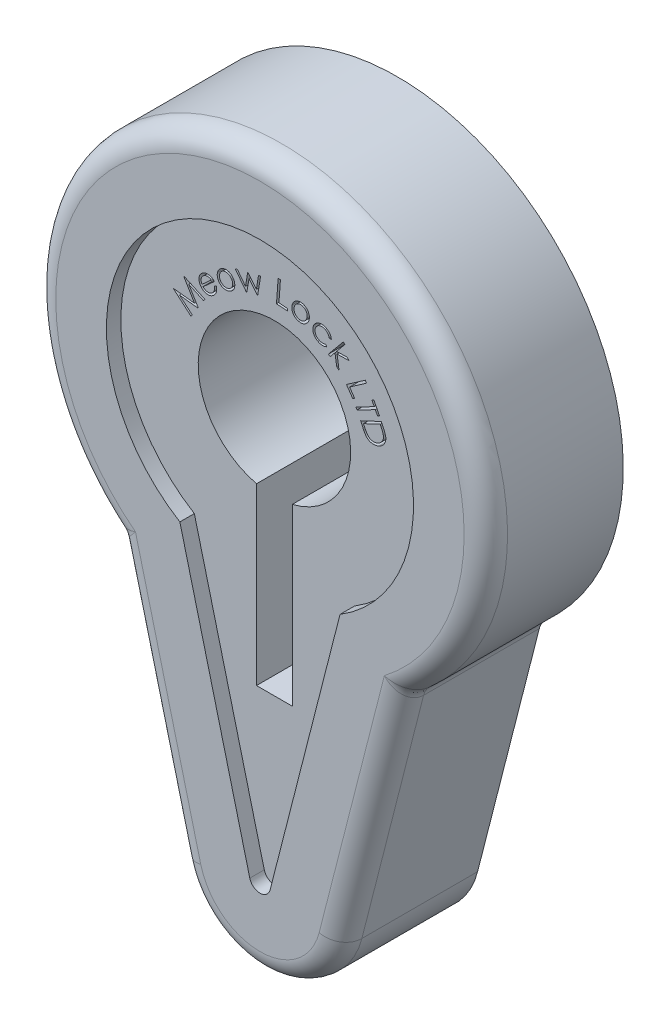
from build123d import *

# Parameters (mm, degrees)
BOSS_EXTRUDE1_DEPTH = 19.000000000000004
FILLET1_R           = 3
FILLET2_R           = 3
FILLET3_R           = 3
CUT_EXTRUDE1_DEPTH  = 1.9999999999999931
CUT_EXTRUDE2_DEPTH  = 79.2107454216423
CUT_EXTRUDE3_DEPTH  = 1.9999999999999931


with BuildPart() as part:
    # Sketch1 → Boss-Extrude1 (new body)
    with BuildSketch(Plane.XY):
        with BuildLine():
            Line((-19.865409477862748, 14.323703405468555), (-11.092882201578892, -19.992359175288826))
            ThreePointArc((-11.092882201578892, -19.992359175288826), (7e-16, -28.606198394562625), (11.092882201578892, -19.992359175288826))
            Line((11.092882201578892, -19.992359175288826), (19.865409477862748, 14.323703405468555))
            ThreePointArc((19.865409477862748, 14.323703405468555), (-5.74e-15, 69.65907877665661), (-19.865409477862748, 14.323703405468555))
        make_face()
    extrude(amount=BOSS_EXTRUDE1_DEPTH)

    # Fillet1
    fillet1_edges = [part.edges().sort_by_distance(p)[0] for p in [
        (15.47914583972082, -2.8343278849101345, 19.000000000000004),
        (-15.47914583972082, -2.8343278849101363, 19.000000000000004),
        (0, -28.606198394562625, 19.000000000000004),
    ]]
    fillet(fillet1_edges, radius=FILLET1_R)

    # Fillet2
    fillet2_edges = [part.edges().sort_by_distance(p)[0] for p in [
        (0, 69.6590787766566, 18.99999999999999),
    ]]
    fillet(fillet2_edges, radius=FILLET2_R)

    # Fillet3
    fillet3_edges = [part.edges().sort_by_distance(p)[0] for p in [
        (-19.86540947786275, 14.323703405468557, 8.000000000000004),
        (19.865409477862748, 14.323703405468557, 8.000000000000004),
        (19.05961196118904, 14.838238555596135, 18.150366096906286),
        (-19.05961189146557, 14.838238600458348, 18.150366161518555),
    ]]
    fillet(fillet3_edges, radius=FILLET3_R)

    # Sketch2 → Cut-Extrude1 (cut)
    with BuildSketch(Plane.XY.offset(19.000000000000004)):
        with BuildLine():
            Line((1.4044485365088668, -17.51561673459423), (11.073713446213294, 20.308272471014167))
            ThreePointArc((11.073713446213294, 20.308272471014167), (-3.41e-15, 59.659078776656614), (-11.07371344621329, 20.30827247101416))
            Line((-11.07371344621329, 20.30827247101416), (-1.404448536508866, -17.51561673459423))
            ThreePointArc((-1.404448536508866, -17.51561673459423), (9e-17, -18.60619839456262), (1.4044485365088668, -17.51561673459423))
        make_face()
    extrude(amount=-CUT_EXTRUDE1_DEPTH, mode=Mode.SUBTRACT)

    # Sketch3 → Cut-Extrude2 (cut, through all)
    with BuildSketch(Plane.XY.offset(17.000000000000007)):
        with BuildLine():
            Line((-2.4743668014019495, 28.18068150354432), (-2.4743668014019504, 4.013199385111004))
            Line((-2.4743668014019504, 4.013199385111004), (2.4743668014019504, 4.013199385111004))
            Line((2.4743668014019504, 4.013199385111004), (2.4743668014019495, 28.18068150354432))
            ThreePointArc((2.4743668014019495, 28.18068150354432), (2.99e-15, 48.96498797298128), (-2.4743668014019495, 28.18068150354432))
        make_face()
    extrude(amount=-CUT_EXTRUDE2_DEPTH, mode=Mode.SUBTRACT)

    # Sketch4 → Cut-Extrude3 (cut)
    # profile 1 of 11: a face of its own
    with BuildSketch(Plane.XY.offset(17.000000000000007)):
        Polygon((-11.528220411843778, 43.698989552974446), (-13.946995451907881, 45.777495161948806), (-13.91964669389506, 45.82074436066675), (-11.044847014407882, 45.507187669961624), (-12.543304546459163, 47.973028014512906), (-12.515955788446341, 48.01627721323085), (-9.611263280433523, 46.69717665233342), (-9.779171934279676, 46.43513738951291), (-11.848137278830958, 47.39170790233342), (-10.546845211523266, 45.23433610746162), (-10.58945839261301, 45.16755425650008), (-13.115720411843778, 45.43976980137188), (-11.364127863766855, 43.95530465714111), align=None)
    # profile 2 of 11: a face of its own
    with BuildSketch(Plane.XY.offset(17.000000000000007)):
        with BuildLine():
            Line((-8.307868744138498, 48.980618327614096), (-8.031837093497472, 49.05058026671666))
            add(Edge.make_bspline(
                [(-8.031837093497472, 49.05058026671666), (-8.021058765235642, 49.00770693293027), (-8.000090236566317, 48.92429968212002), (-7.9829749644515315, 48.799839328524925), (-7.974897868245151, 48.681116589488816), (-7.980485940769286, 48.56756671889005), (-7.995609559294517, 48.458506985152525), (-8.021308032111563, 48.35314943612911), (-8.056473921557949, 48.2509813482197), (-8.101010367847598, 48.151629911480775), (-8.157060639576091, 48.05581542124592), (-8.223390172231074, 47.96238001134475), (-8.302130923872221, 47.87236512953024), (-8.361436943391093, 47.816637812585654), (-8.391823071061575, 47.78808527472948)],
                knots=[0, 0, 0, 0, 1.1438590905906583, 2.225302621340562, 3.2481450048076415, 4.220789270837227, 5.163268732185565, 6.095282394801258, 7.024057077463628, 7.957686016269756, 8.909598699524734, 9.893624532877862, 10.920774073438146, 12, 12, 12, 12], degree=3))
            add(Edge.make_bspline(
                [(-8.391823071061575, 47.78808527472948), (-8.42692061801196, 47.75816788611561), (-8.495466429896702, 47.69973896813714), (-8.604734472422011, 47.62511814703318), (-8.715810895643083, 47.5640632173655), (-8.829208825893662, 47.51705270395203), (-8.944920046102176, 47.48434188101941), (-9.062790970982416, 47.4659877385666), (-9.182512617821917, 47.46061076268523), (-9.302686144155272, 47.47011211941893), (-9.42085380217285, 47.49057850703038), (-9.535092137550512, 47.51985134178579), (-9.644229649919888, 47.5575351781606), (-9.747112875800028, 47.606242295188025), (-9.845383388255128, 47.661645721249684), (-9.93760793908266, 47.7273462364851), (-10.024396361591878, 47.80176205856189), (-10.077305766316616, 47.85736243318679), (-10.103982526189778, 47.885395971844865)],
                knots=[0, 0, 0, 0, 1.1536230738502677, 2.2530358123836787, 3.3049543798690557, 4.3208865292682725, 5.318698547090505, 6.3070838604391755, 7.30024332343403, 8.311146831330861, 9.31782197104366, 10.298485852697238, 11.26007268334896, 12.20250999104727, 13.143661796260414, 14.08001483569733, 15.031949358443926, 16, 16, 16, 16], degree=3))
            add(Edge.make_bspline(
                [(-10.103982526189778, 47.885395971844865), (-10.127512971532592, 47.913043381914434), (-10.17411696411035, 47.967801363537994), (-10.236063448362435, 48.0551690280961), (-10.28913361046315, 48.14657448998163), (-10.333300780811587, 48.24154400937473), (-10.370999198487095, 48.33922447132257), (-10.398624056809355, 48.44093730890156), (-10.418797835186188, 48.54598978089763), (-10.42514781942697, 48.61758434320774), (-10.428351516574395, 48.65370526671666)],
                knots=[0, 0, 0, 0, 1.024724262101067, 2.0295511287375727, 3.019287489792112, 4.004724375493079, 4.984179798432329, 5.9717234074878185, 6.976692903914447, 8, 8, 8, 8], degree=3))
            add(Edge.make_bspline(
                [(-10.428351516574395, 48.65370526671666), (-10.430343017139245, 48.69930638138516), (-10.43425129333863, 48.78879756922106), (-10.420507272739343, 48.92066491938643), (-10.394227536568373, 49.04745183531208), (-10.35170338033726, 49.16856889758352), (-10.29550268565386, 49.2846859324387), (-10.22396470101874, 49.3949055431992), (-10.137783832181027, 49.4997436231726), (-10.07118434982962, 49.56324471381298), (-10.037200675228242, 49.59564737408846)],
                knots=[0, 0, 0, 0, 1.0336598934106789, 2.0285348801689875, 2.996773982118614, 3.9636160249169365, 4.9310434063997475, 5.915047668378666, 6.936112727973667, 8, 8, 8, 8], degree=3))
            add(Edge.make_bspline(
                [(-10.037200675228242, 49.59564737408846), (-10.000347811568982, 49.62705761468548), (-9.9282392142545, 49.68851683836218), (-9.81074758690962, 49.76407263156367), (-9.690385953328672, 49.82561110404495), (-9.565595224260719, 49.87086969719863), (-9.436900393279103, 49.901295379485965), (-9.304254942564052, 49.914779519050875), (-9.167762977487431, 49.91427571192186), (-9.076712798327772, 49.90079757105454), (-9.030384769779522, 49.89393964171666)],
                knots=[0, 0, 0, 0, 1.0656996695864305, 2.08521402957729, 3.069002469526955, 4.0382376352531155, 5.0023278210328845, 5.974562869772089, 6.969419829176341, 8, 8, 8, 8], degree=3))
            add(Edge.make_bspline(
                [(-9.030384769779522, 49.89393964171666), (-8.997150749776107, 49.88738559013001), (-8.930935941242442, 49.87432742651074), (-8.834206953339553, 49.842962785094734), (-8.740068007740481, 49.803420327812766), (-8.647785275666747, 49.755718003062356), (-8.558926763666086, 49.69791246284353), (-8.47182766400062, 49.63224618936525), (-8.387910317634136, 49.55702644189416), (-8.33527039274791, 49.5016758854268), (-8.308504761766702, 49.473531989473074)],
                knots=[0, 0, 0, 0, 0.9545090097054427, 1.9017449984928285, 2.8610348000897012, 3.8316766621973746, 4.8266649342231895, 5.846575002408617, 6.905055830611258, 8, 8, 8, 8], degree=3))
            Line((-8.308504761766702, 49.473531989473074), (-9.86356786272824, 48.07810931319102))
            add(Edge.make_bspline(
                [(-9.86356786272824, 48.07810931319102), (-9.840462368386657, 48.05433176362649), (-9.795207847392861, 48.007760952370894), (-9.721161439779744, 47.94678779813404), (-9.645766743185494, 47.89275927253474), (-9.566941430813861, 47.84821567594281), (-9.485844475251286, 47.81126350537934), (-9.401539654827785, 47.78449581310902), (-9.315306180672025, 47.76407452449261), (-9.227206189967953, 47.75380141660064), (-9.139052775880431, 47.750883581105455), (-9.052750365233615, 47.75732836344219), (-8.968924505505091, 47.77194270261312), (-8.888134298163392, 47.79554548567846), (-8.80985720535769, 47.82784238008361), (-8.734222069335223, 47.86770680414436), (-8.661361253901427, 47.91663534535992), (-8.616401083932578, 47.954898216319556), (-8.5934406592026, 47.97443843979359)],
                knots=[0, 0, 0, 0, 1.119043766819481, 2.1917639540553124, 3.2348192654034276, 4.248252130155229, 5.245079207590165, 6.239201955029596, 7.2310783862674795, 8.233854885788164, 9.229626860755625, 10.206133318021047, 11.151502815611664, 12.09874178541099, 13.042890067714005, 14.007083686134562, 14.982250177226693, 16, 16, 16, 16], degree=3))
            add(Edge.make_bspline(
                [(-8.5934406592026, 47.97443843979359), (-8.572072948482955, 47.994632999038366), (-8.529384853149876, 48.03497738976706), (-8.472161167462158, 48.1021403156907), (-8.42120996620256, 48.17416394653622), (-8.376883072859716, 48.25023085603603), (-8.339729356021786, 48.328626467495255), (-8.309413835438487, 48.40712652786694), (-8.288449111764416, 48.485648362033764), (-8.274194821005874, 48.565610137248306), (-8.269595661970495, 48.652405485875235), (-8.27306477891565, 48.75028158734608), (-8.286417093926419, 48.86132145335515), (-8.300447605850804, 48.93934790820988), (-8.307868744138498, 48.980618327614096)],
                knots=[0, 0, 0, 0, 0.9593845061067605, 1.916644126977698, 2.875004276622384, 3.8366335435139685, 4.787162427676125, 5.705072645538446, 6.579899817758501, 7.436798075012327, 8.352173165925164, 9.411798250351984, 10.631026208872806, 12.000000000000002, 12.000000000000002, 12.000000000000002, 12.000000000000002], degree=3))
        make_face()
        with BuildLine():
            add(Edge.make_bspline(
                [(-8.725732325869265, 49.44618323146025), (-8.75884987915922, 49.46759644852095), (-8.822636236766693, 49.50883956539622), (-8.92080811423176, 49.558147280844366), (-9.016235301156527, 49.593505866912835), (-9.109414370474065, 49.61681714899258), (-9.202535861080952, 49.6262224136776), (-9.29684081028695, 49.62393041565976), (-9.393413785680321, 49.611429103673466), (-9.490580698158512, 49.58604956579941), (-9.586698732016451, 49.55195928333079), (-9.677969021036322, 49.50623845996615), (-9.764181811014188, 49.451516383696315), (-9.816324275285808, 49.40778259083461), (-9.842579280997471, 49.385761556780764)],
                knots=[0, 0, 0, 0, 1.1680407326493345, 2.249715225655339, 3.2475188039865586, 4.17851287959102, 5.088063470543937, 6.011758523411509, 6.968675398606141, 7.966696503360424, 8.982201947059025, 9.9852131391381, 10.985505551403293, 12.000000000000002, 12.000000000000002, 12.000000000000002, 12.000000000000002], degree=3))
            add(Edge.make_bspline(
                [(-9.842579280997471, 49.385761556780764), (-9.863150329751418, 49.366670904704556), (-9.903579634335731, 49.32915109729299), (-9.956203828762401, 49.2663185979229), (-10.003910138392412, 49.20196938175793), (-10.043157463139172, 49.1331228218172), (-10.076749901651109, 49.062121953130884), (-10.101778845774286, 48.987214299461), (-10.122336969728119, 48.910030550045036), (-10.12916729276333, 48.8567068781207), (-10.13260331945901, 48.829882149729485)],
                knots=[0, 0, 0, 0, 1.048450613626152, 2.0605721033920967, 3.0596301875698337, 4.040049446146365, 5.019025189073001, 5.991817865452182, 6.98977436520581, 8, 8, 8, 8], degree=3))
            add(Edge.make_bspline(
                [(-10.13260331945901, 48.829882149729485), (-10.134213706135688, 48.80975635021686), (-10.137499289874198, 48.768694783724236), (-10.136068030311256, 48.705871868537415), (-10.128713617190842, 48.64107830520338), (-10.116685203926862, 48.57454934734839), (-10.0992764662448, 48.50591214204925), (-10.076456334956799, 48.435542349374856), (-10.047433695507326, 48.36334571380077), (-10.025125858983014, 48.31524491604184), (-10.01366802298465, 48.29053920101153)],
                knots=[0, 0, 0, 0, 0.8657182429490679, 1.7662775172947558, 2.6902742414086065, 3.6607263184247656, 4.664362914906172, 5.725641064815329, 6.831835097394663, 8, 8, 8, 8], degree=3))
            Line((-10.01366802298465, 48.29053920101153), (-8.725732325869265, 49.44618323146025))
        make_face(mode=Mode.SUBTRACT)
    # profile 3 of 11: a face of its own
    with BuildSketch(Plane.XY.offset(17.000000000000007)):
        with BuildLine():
            add(Edge.make_bspline(
                [(-7.284925482100692, 51.55443375281094), (-7.246106905400382, 51.57481346768673), (-7.16994971632399, 51.614795917612746), (-7.050364866065282, 51.659011405551226), (-6.930564681927803, 51.69131096178086), (-6.809641476192095, 51.710073458580695), (-6.687768403084962, 51.714436827791545), (-6.5652941901590935, 51.70504007847492), (-6.441351276364996, 51.6840646589331), (-6.360550840157206, 51.658847369885656), (-6.319450722485308, 51.64602029127247)],
                knots=[0, 0, 0, 0, 1.0510728326636163, 2.0620733487527874, 3.051704453714321, 4.024428814301694, 4.9916436827636135, 5.970970230690866, 6.967909504053517, 8, 8, 8, 8], degree=3))
            add(Edge.make_bspline(
                [(-6.319450722485308, 51.64602029127247), (-6.282511305180886, 51.63223310781736), (-6.209667391037816, 51.60504501224992), (-6.106023718528669, 51.55376190806075), (-6.009373592435655, 51.49387970030754), (-5.920329795722009, 51.424536233865574), (-5.836830598932785, 51.348171049579776), (-5.76122586425304, 51.26237847562316), (-5.691913865432661, 51.168558999890955), (-5.6521022130722525, 51.10090982716273), (-5.631915666395563, 51.066608231977604)],
                knots=[0, 0, 0, 0, 1.02740304921889, 2.0260216584052495, 3.0091169531528115, 3.986399721502748, 4.9642449907731825, 5.954770024698545, 6.962963657292383, 7.999999999999999, 7.999999999999999, 7.999999999999999, 7.999999999999999], degree=3))
            add(Edge.make_bspline(
                [(-5.631915666395563, 51.066608231977604), (-5.613429871378645, 51.03109705337416), (-5.576863400877112, 50.960852930051956), (-5.534390814994357, 50.851057694441046), (-5.502998097570921, 50.739659478042235), (-5.482384710788375, 50.62659852601419), (-5.473485230654402, 50.51151619002507), (-5.476317740031852, 50.39461048711095), (-5.489783964504364, 50.276065397482554), (-5.513858056772879, 50.15729225449726), (-5.547956665073841, 50.0407606996259), (-5.59497858069571, 49.93043017962092), (-5.65150832631415, 49.82631760831767), (-5.720272726775508, 49.73021045358311), (-5.798845902536664, 49.64018172793704), (-5.88924294320922, 49.55846123485502), (-5.989471962232391, 49.48226546145156), (-6.063065045312663, 49.439342208125794), (-6.100660658382743, 49.4174145220417)],
                knots=[0, 0, 0, 0, 1.0047810835139046, 1.9875422083379555, 2.949960505687523, 3.9075956170834707, 4.868820349364886, 5.843355690440343, 6.839922086220151, 7.861086968353467, 8.883541787284646, 9.883246222354387, 10.867333222128522, 11.852643629373244, 12.844820094629513, 13.862286452042053, 14.907931995238854, 16, 16, 16, 16], degree=3))
            add(Edge.make_bspline(
                [(-6.100660658382743, 49.4174145220417), (-6.139317271361393, 49.39736453252659), (-6.215114581080322, 49.35805081236237), (-6.332862734525234, 49.312968307953895), (-6.450375286173977, 49.28013883554905), (-6.568235204505501, 49.25995167429047), (-6.686439724204732, 49.253784790883145), (-6.804777824201915, 49.26014454128663), (-6.923281665623998, 49.27951474329861), (-7.0405177633066796, 49.311309279411276), (-7.154195393172494, 49.35352747110863), (-7.261417808409891, 49.40522881738554), (-7.361468686299787, 49.465242680368775), (-7.453896607454233, 49.53433251373415), (-7.539537193850497, 49.6113964395267), (-7.617323608911687, 49.69715532867587), (-7.688138361950699, 49.79111948849678), (-7.72824052287724, 49.85923841744825), (-7.74858233306223, 49.89379172556734)],
                knots=[0, 0, 0, 0, 1.0924372358046368, 2.1420346256539866, 3.158178381317194, 4.151203793054788, 5.137188006524576, 6.123172219994356, 7.120580237808654, 8.1455905390487, 9.167737001136768, 10.160305967488783, 11.129588791415845, 12.091789131687518, 13.05263450846163, 14.017054629867637, 14.994151502201376, 16, 16, 16, 16], degree=3))
            add(Edge.make_bspline(
                [(-7.74858233306223, 49.89379172556734), (-7.767130379945928, 49.928853056503385), (-7.803680220775308, 49.997943137686285), (-7.845125429028069, 50.10638799965399), (-7.877684473245864, 50.21555922174676), (-7.898236008633888, 50.326432190406905), (-7.90975445971219, 50.438591173896135), (-7.908380539801833, 50.55188302083292), (-7.898187325936164, 50.66674766881394), (-7.882481637734536, 50.74257007290676), (-7.874513823446845, 50.7810363169135)],
                knots=[0, 0, 0, 0, 1.0367981504067525, 2.0430618709978523, 3.031187113600469, 4.013442315142226, 4.988609980860503, 5.975863174035718, 6.973114319149546, 8, 8, 8, 8], degree=3))
            add(Edge.make_bspline(
                [(-7.874513823446845, 50.7810363169135), (-7.863773011475723, 50.822667717662576), (-7.842587472072929, 50.90478289511233), (-7.79523638015018, 51.02157838658548), (-7.738132623546758, 51.130952059895435), (-7.669452125895937, 51.23232424567284), (-7.589627826653985, 51.325538655562376), (-7.498442528122253, 51.4103847696534), (-7.397016967341489, 51.48812561702984), (-7.322728442396157, 51.53207127078284), (-7.284925482100692, 51.55443375281094)],
                knots=[0, 0, 0, 0, 1.0276362309491365, 2.026944324232058, 3.0070565329886936, 3.974913225477878, 4.949761777002653, 5.9365704987080345, 6.94998933459462, 8, 8, 8, 8], degree=3))
        make_face()
        with BuildLine():
            add(Edge.make_bspline(
                [(-7.143093551010948, 51.29875466627247), (-7.1693264730080415, 51.28341318889714), (-7.221169029050477, 51.253094743979254), (-7.291745629790258, 51.198348829998636), (-7.356035957808402, 51.13842397558384), (-7.4127248633156, 51.07188240802486), (-7.462582228748052, 50.9996400173125), (-7.50550809408066, 50.92146806597473), (-7.540967023256621, 50.83719702293546), (-7.569373447538206, 50.74824272299519), (-7.589544126525805, 50.65689112090247), (-7.6011479149071, 50.56535285188849), (-7.604026845224861, 50.47455822595054), (-7.596550924882193, 50.38471946152875), (-7.581579123670089, 50.29553678876489), (-7.556378672954552, 50.207369851231896), (-7.522064235574011, 50.12012374909619), (-7.492983650560558, 50.06400714483764), (-7.47827484107505, 50.035623656657094)],
                knots=[0, 0, 0, 0, 1.0034107536079466, 1.9829807077254398, 2.944594866886022, 3.903678626238743, 4.865726628940105, 5.840951902503809, 6.845609478828523, 7.882631670645947, 8.923033140926993, 9.932881395290082, 10.928211384406834, 11.919141939555695, 12.907468139719073, 13.91224787028789, 14.944025771328535, 16, 16, 16, 16], degree=3))
            add(Edge.make_bspline(
                [(-7.47827484107505, 50.035623656657094), (-7.456896855091548, 50.000246627709735), (-7.414547263545623, 49.93016506215977), (-7.335686631995793, 49.836079728213), (-7.246179278507361, 49.75265346750642), (-7.146095611609081, 49.68195835564026), (-7.0387898868199725, 49.62478373007256), (-6.927148360567625, 49.58211709963092), (-6.811624634428654, 49.55664322042723), (-6.694021780070902, 49.5464328616745), (-6.575850376671836, 49.55196850560439), (-6.4596477218736865, 49.57418927282326), (-6.345799090999233, 49.610814491741635), (-6.274287494388099, 49.647079685832736), (-6.238040466075051, 49.6654613970417)],
                knots=[0, 0, 0, 0, 1.0311589401216605, 2.042716276770876, 3.054370626022889, 4.079898984930302, 5.09378206205966, 6.08416199243224, 7.0553876998272775, 8.038664170870513, 9.024731296067593, 9.999932966322822, 10.98622755142898, 12, 12, 12, 12], degree=3))
            add(Edge.make_bspline(
                [(-6.238040466075051, 49.6654613970417), (-6.203304929388646, 49.686421309125734), (-6.1347590185381495, 49.727782877196994), (-6.043129969717382, 49.80465949974578), (-5.963030250689133, 49.891565805031135), (-5.8954861566353385, 49.98854240963535), (-5.841347259058597, 50.09373718257502), (-5.801332370995752, 50.20524797575099), (-5.778752998299101, 50.32299465389078), (-5.770593873852886, 50.444316187938725), (-5.77737790068395, 50.56680514312986), (-5.799892538153065, 50.68716574473711), (-5.837835047966715, 50.80398437003791), (-5.875139508258821, 50.87709091788874), (-5.893954929216076, 50.91396400120837)],
                knots=[0, 0, 0, 0, 1.011421806542982, 1.9959049318699869, 2.973408501862481, 3.9540440269745973, 4.936248912336552, 5.918724615121045, 6.9005017419295, 7.918863130061691, 8.947130884117236, 9.953890456993854, 10.967994387940115, 12, 12, 12, 12], degree=3))
            add(Edge.make_bspline(
                [(-5.893954929216076, 50.91396400120837), (-5.910145771847046, 50.941677353729716), (-5.942006432141236, 50.996212236837444), (-5.998764157399547, 51.07067729502069), (-6.059916765078916, 51.13870263345155), (-6.126882001964633, 51.19946128101028), (-6.1999761648885245, 51.25247564106061), (-6.278611973359187, 51.298417778301584), (-6.362690511803268, 51.337340846231456), (-6.451464579560849, 51.36798023123743), (-6.54176155613338, 51.3916210826432), (-6.632126462190487, 51.405685510215434), (-6.720947414161427, 51.410870841028085), (-6.808606561625465, 51.40729610717168), (-6.894910246834481, 51.3936410494157), (-6.979711610051424, 51.371300127267354), (-7.063160275261275, 51.34013446524225), (-7.116214500967462, 51.31266939298505), (-7.143093551010948, 51.29875466627247)],
                knots=[0, 0, 0, 0, 1.060114480101381, 2.086114237121607, 3.088358705535749, 4.080704342151428, 5.068958325680422, 6.067791159683567, 7.086874309369597, 8.126380275979617, 9.168340248377413, 10.168450739779983, 11.144201006385673, 12.105243176684409, 13.062726914879741, 14.02655031991081, 15.000184207697636, 16, 16, 16, 16], degree=3))
        make_face(mode=Mode.SUBTRACT)
    # profile 4 of 11: a face of its own
    with BuildSketch(Plane.XY.offset(17.000000000000007)):
        Polygon((-5.417018976234971, 52.44805020569272), (-5.11681865572215, 52.52373630344913), (-4.00442382399138, 51.05135549415425), (-3.693411203799073, 52.88435829864144), (-3.6412577582862524, 52.89707865120553), (-2.497698062773432, 51.43233005344913), (-2.2076740243118933, 53.26024471691067), (-1.9030215804016373, 53.337202849923486), (-2.3132529505939448, 50.81730100697477), (-2.3692225018759965, 50.80330861915425), (-3.5026059153375346, 52.24579659992348), (-3.8199787118118937, 50.43569043005169), (-3.8740402102093294, 50.42233405985938), align=None)
    # profile 5 of 11: a face of its own
    with BuildSketch(Plane.XY.offset(17.000000000000007)):
        Polygon((0.5125004094882456, 54.26858359847568), (0.8305092235908096, 54.2456869638603), (0.6257115473087583, 51.3925118837321), (1.838597164295938, 51.30537746866799), (1.8169725649369635, 51.000725024757735), (0.2860781338472198, 51.11075607443722), align=None)
    # profile 6 of 11: a face of its own
    with BuildSketch(Plane.XY.offset(17.000000000000007)):
        with BuildLine():
            add(Edge.make_bspline(
                [(3.9392155553274355, 52.92407850823215), (3.9812923675503207, 52.911609670155485), (4.064186820759115, 52.88704513068802), (4.181166737399798, 52.835541953352475), (4.289730109157878, 52.774821438565546), (4.389734198734371, 52.70405704332951), (4.480388361600734, 52.62185343258929), (4.562603801657075, 52.53012278728229), (4.6361899840240195, 52.42805251408689), (4.676715765479204, 52.35383291710332), (4.697348568147947, 52.31604565566805)],
                knots=[0, 0, 0, 0, 1.049976079191052, 2.068531059477844, 3.052728478104697, 4.024686764490714, 4.995198910623399, 5.976656159940358, 6.96985936645945, 8, 8, 8, 8], degree=3))
            add(Edge.make_bspline(
                [(4.697348568147947, 52.31604565566805), (4.714362541481687, 52.280510508020484), (4.747978779638161, 52.21030010138507), (4.785928047356075, 52.100867041931984), (4.813571813896022, 51.99041687707764), (4.830274402344226, 51.87836679827681), (4.835696696612824, 51.765068121952865), (4.83147812060059, 51.65028989949363), (4.815527500430347, 51.53445440522801), (4.797014838076326, 51.457921693400756), (4.787663071353077, 51.419260799898815)],
                knots=[0, 0, 0, 0, 1.0241177677544018, 2.023453669863044, 3.0064832450138126, 3.982107098434566, 4.964935580191844, 5.95277911600543, 6.965835827825978, 7.999999999999999, 7.999999999999999, 7.999999999999999, 7.999999999999999], degree=3))
            add(Edge.make_bspline(
                [(4.787663071353077, 51.419260799898815), (4.776345869182744, 51.38083159789208), (4.753962666739661, 51.304826186369276), (4.707310050496531, 51.19652653718144), (4.652923161423158, 51.094098744362164), (4.587853160883856, 50.99875547013957), (4.514157360559191, 50.909555557703), (4.430808512871477, 50.82722027402654), (4.338721761516365, 50.751126944181436), (4.23848339303226, 50.68258147859434), (4.132483356011958, 50.622641027728385), (4.021966591215481, 50.575432772353075), (3.908569969521659, 50.54061091670961), (3.7920403159530434, 50.51916079035845), (3.672678708419278, 50.5094272260919), (3.5505715902227615, 50.51296805679416), (3.4256226491588766, 50.52863486914877), (3.342887239453216, 50.54897968602824), (3.300653856609486, 50.55936496656548)],
                knots=[0, 0, 0, 0, 1.0033864258521794, 1.9845012186285824, 2.9498298623649375, 3.9064300338034528, 4.872635956788852, 5.845904190678062, 6.83865121106387, 7.863109038435384, 8.886159964945286, 9.88610664975491, 10.869535921254453, 11.853467619886045, 12.850430205791731, 13.865805682782273, 14.910572317431793, 16, 16, 16, 16], degree=3))
            add(Edge.make_bspline(
                [(3.300653856609486, 50.55936496656548), (3.258830326890632, 50.57171988970578), (3.176614065107641, 50.59600706972238), (3.0600490949324026, 50.64529573223566), (2.952295725079867, 50.703931653342316), (2.853957402531181, 50.77262892063115), (2.763497879030131, 50.84947949705914), (2.6830639627484305, 50.937083930462975), (2.6106607172605596, 51.03325813263554), (2.5492128589239194, 51.13850770567796), (2.4974903504100143, 51.248498903671866), (2.4557334808414875, 51.36052558515271), (2.4258495052392304, 51.47368716918298), (2.406351852660166, 51.58754124628243), (2.3987594140857174, 51.70262842158339), (2.402723077854849, 51.818699583268845), (2.4177944120647488, 51.93568143007984), (2.4364298865013665, 52.01259754710639), (2.4458461643017944, 52.051462322334714)],
                knots=[0, 0, 0, 0, 1.090953335009587, 2.1445847729045506, 3.161075559529475, 4.15624432969066, 5.142272680090007, 6.12615652458589, 7.12703963444356, 8.150048224783232, 9.170852052666975, 10.166530092147422, 11.138404191163744, 12.09635592196885, 13.05371948317785, 14.020101164370203, 14.999581281579818, 16, 16, 16, 16], degree=3))
            add(Edge.make_bspline(
                [(2.4458461643017944, 52.051462322334714), (2.457229306678852, 52.089656056132704), (2.4796407276014873, 52.164852852974924), (2.5249555493911027, 52.27211745478215), (2.577456006152775, 52.37357062134247), (2.6404812041161962, 52.46742369982345), (2.7102695284546177, 52.55630655479828), (2.790616171460164, 52.63681209890321), (2.878384581150307, 52.71198781848073), (2.9425611431109564, 52.75569391492153), (2.9750128309684607, 52.77779445374497)],
                knots=[0, 0, 0, 0, 1.0389574779519817, 2.045525970581789, 3.0325940666537257, 4.014302139896892, 4.990323089203021, 5.9758560741607, 6.976466098319868, 8, 8, 8, 8], degree=3))
            add(Edge.make_bspline(
                [(2.9750128309684607, 52.77779445374497), (3.0119091536621414, 52.80017615626083), (3.0846819266161645, 52.84432089580666), (3.1997672099755756, 52.896661718295405), (3.3175625271392835, 52.93507298825851), (3.437664059139016, 52.96007006463569), (3.5601040789008103, 52.97133227285431), (3.6848118868307167, 52.97019673017448), (3.8121688098499242, 52.95495349340687), (3.896352249080284, 52.934495177623766), (3.9392155553274355, 52.92407850823215)],
                knots=[0, 0, 0, 0, 1.028687273277524, 2.028940011188161, 3.0076382839684928, 3.9785846548622352, 4.948740567249732, 5.9348964651133675, 6.948520444672007, 8, 8, 8, 8], degree=3))
        make_face()
        with BuildLine():
            add(Edge.make_bspline(
                [(3.862257422314615, 52.64105066368087), (3.8324890593079077, 52.648282169121096), (3.773869865246059, 52.66252228775525), (3.6846414739538624, 52.67228221372246), (3.596676221860927, 52.67372502969739), (3.5094323447436016, 52.666160795318085), (3.4230741099167337, 52.6488024714372), (3.337720691192211, 52.62183764282162), (3.253420407295034, 52.58598262685496), (3.1712941367510084, 52.54162862311075), (3.09302057957517, 52.490078597193445), (3.02108460540779, 52.43190195317263), (2.955284497324245, 52.368966519315926), (2.8983825026780208, 52.29884175586656), (2.8466296618665803, 52.22436160240777), (2.8037228661979814, 52.143245921172706), (2.767688022785002, 52.056714128417084), (2.749546220384672, 51.99631093170765), (2.7403223261607685, 51.96559994252702)],
                knots=[0, 0, 0, 0, 1.009418667368903, 1.9877246437373262, 2.9527224529322167, 3.9073293991394196, 4.869943178986772, 5.851815667409821, 6.854382173052214, 7.8867391161933895, 8.926175161305451, 9.94061824669062, 10.934491638128438, 11.922840453553004, 12.9138567486403, 13.921117888562618, 14.943027364275844, 16, 16, 16, 16], degree=3))
            add(Edge.make_bspline(
                [(2.7403223261607685, 51.96559994252702), (2.730665609374225, 51.92509027196625), (2.7115791644036715, 51.84502314200642), (2.7036662546159196, 51.72202943484874), (2.7097164713700406, 51.59962321636704), (2.731916096115836, 51.47877997725294), (2.7692842204693644, 51.36274009825062), (2.8204893303552128, 51.254270995084646), (2.8850345924991534, 51.154526427813714), (2.9638157667903746, 51.06588891642366), (3.052600781106422, 50.987074829479134), (3.1519293342035324, 50.92240849155238), (3.259408598249619, 50.869380299250984), (3.3360853927003613, 50.846007385000796), (3.3750679191094863, 50.8341245819501)],
                knots=[0, 0, 0, 0, 1.0353308312795233, 2.04632541000589, 3.0559960108696904, 4.081074584062919, 5.096099374638961, 6.083160044167394, 7.059789901108411, 8.043570068835509, 9.027350236562597, 10.006872087273852, 10.986692622570118, 12, 12, 12, 12], degree=3))
            add(Edge.make_bspline(
                [(3.3750679191094863, 50.8341245819501), (3.414736140563879, 50.82476193561528), (3.4929411316902046, 50.806303692550955), (3.6125037538509552, 50.79783224556862), (3.730459912660629, 50.80497302567752), (3.846596048019172, 50.82692692491527), (3.958409048001658, 50.86557151798531), (4.06510157926343, 50.917544802472676), (4.163763347245854, 50.98613709520006), (4.254088956060399, 51.06799910982483), (4.335041123227413, 51.16082425953677), (4.401524305496178, 51.26407250217372), (4.456665187499991, 51.374501556653954), (4.48090955590209, 51.45319066345317), (4.493186909494101, 51.49303884477061)],
                knots=[0, 0, 0, 0, 1.0136071932890154, 1.9983033937602546, 2.971398032738563, 3.9498051738542044, 4.9314399589579825, 5.908863897793095, 6.895821691046948, 7.9125173787265695, 8.938055963586542, 9.952776097785382, 10.963285357133417, 12, 12, 12, 12], degree=3))
            add(Edge.make_bspline(
                [(4.493186909494101, 51.49303884477061), (4.500773183119426, 51.52408459049844), (4.515773144588789, 51.58546979919307), (4.527732197483006, 51.6784021103579), (4.530279465219497, 51.77022071658066), (4.523989732698643, 51.86056449052778), (4.5086247006110005, 51.94963910595217), (4.4840732286298435, 52.03730575277887), (4.451244051475687, 52.124051887713875), (4.408310200499404, 52.20787339440163), (4.359743361052605, 52.28782234475559), (4.304537723347323, 52.361105314296374), (4.2438503364468465, 52.42673288123694), (4.178447957483865, 52.485638328388255), (4.107143837103183, 52.53638687826663), (4.030303831617589, 52.57877674564126), (3.9487612186025185, 52.61510781587708), (3.8913106241074558, 52.632337487789535), (3.862257422314615, 52.64105066368087)],
                knots=[0, 0, 0, 0, 1.0538083121404562, 2.0836427551775722, 3.084273167876859, 4.079977536060403, 5.0666241368259115, 6.061074731960466, 7.079515450115704, 8.121182708288556, 9.163671591072976, 10.162515752207273, 11.14261987789069, 12.108620327145783, 13.061592475665579, 14.02292205920129, 15.000176675645445, 16, 16, 16, 16], degree=3))
        make_face(mode=Mode.SUBTRACT)
    # profile 7 of 11: a face of its own
    with BuildSketch(Plane.XY.offset(17.000000000000007)):
        with BuildLine():
            Line((7.866333886730744, 50.64347860879906), (7.587758165576898, 50.624398079952904))
            add(Edge.make_bspline(
                [(7.587758165576898, 50.624398079952904), (7.580002361989596, 50.6653292578554), (7.564751171981541, 50.74581726459997), (7.526050353624652, 50.86121259762136), (7.474902219531482, 50.96842517007969), (7.41229643265858, 51.06819083768224), (7.3365005862150605, 51.158986176739134), (7.248411577658876, 51.24135453419987), (7.1487535885148965, 51.31654618468555), (7.07521109440576, 51.35852161648084), (7.037602917179461, 51.3799870222606)],
                knots=[0, 0, 0, 0, 1.0282959133261311, 2.022064661915753, 2.996656352775062, 3.9571424024173565, 4.9241610422117645, 5.909752766508682, 6.931088898246155, 8, 8, 8, 8], degree=3))
            add(Edge.make_bspline(
                [(7.037602917179461, 51.3799870222606), (7.0064802486644675, 51.395596315091574), (6.945355256241726, 51.42625300205136), (6.8508222522981574, 51.46197968973384), (6.756407358356155, 51.48747112370255), (6.661867068081521, 51.503741852780166), (6.567236309574707, 51.510046396080696), (6.472428511546742, 51.506812155754275), (6.377739779853456, 51.494169688267725), (6.284384482358332, 51.471084082862895), (6.193972735953302, 51.440117725775934), (6.108269987697884, 51.40217659038872), (6.0287953420478, 51.35600671663143), (5.955493604224963, 51.302243327912116), (5.887492076439419, 51.24173375378804), (5.826478152882013, 51.17318617662325), (5.771028840740195, 51.09768986663171), (5.7400040780820705, 51.042817900649545), (5.7242265149358715, 51.01491290367085)],
                knots=[0, 0, 0, 0, 1.0985066444977276, 2.1574695720229595, 3.1834391503421746, 4.181305539969513, 5.180674285381802, 6.171672810142462, 7.17110877239288, 8.19042182764655, 9.202016879608104, 10.184551091940945, 11.144117750395157, 12.09715149171556, 13.049715202556891, 14.011728995937341, 14.988869901631983, 16, 16, 16, 16], degree=3))
            add(Edge.make_bspline(
                [(5.7242265149358715, 51.01491290367085), (5.705987322911073, 50.977188987790235), (5.669710415456994, 50.90215786780718), (5.634343234937179, 50.782029054308694), (5.615379029154553, 50.65776227446059), (5.61142910531698, 50.53105246943774), (5.623910749888918, 50.404585529783745), (5.653465787406478, 50.28226399536903), (5.698929249786904, 50.164932005757834), (5.761654158416995, 50.054698013877186), (5.838446337111202, 49.95170219843321), (5.930630984563111, 49.86004238149989), (6.0348147575281175, 49.7772534066241), (6.112615428405077, 49.73257499187127), (6.152266378717924, 49.70980473059393)],
                knots=[0, 0, 0, 0, 0.9838449951006684, 1.9568220888239836, 2.930360770800106, 3.9326685407830593, 4.9295581225483245, 5.908796460256797, 6.882539275840786, 7.8779199578664745, 8.881775713565391, 9.893311304861324, 10.926330482320827, 12, 12, 12, 12], degree=3))
            add(Edge.make_bspline(
                [(6.152266378717924, 49.70980473059393), (6.189813043808296, 49.691050527403675), (6.263449098300059, 49.65427001641175), (6.379146830382293, 49.616036436492614), (6.494750680752448, 49.58958171914569), (6.61166518290693, 49.57927882025662), (6.7293476095644715, 49.581270447785656), (6.847591037164882, 49.59941334879097), (6.967176608653318, 49.62940911038419), (7.0444989293890465, 49.66072212752624), (7.084032204038436, 49.67673181392726)],
                knots=[0, 0, 0, 0, 1.0406810887139257, 2.0409708604649297, 3.0165867001786935, 3.9786500732163566, 4.947298920127886, 5.931297306908517, 6.942315867452635, 7.999999999999999, 7.999999999999999, 7.999999999999999, 7.999999999999999], degree=3))
            Line((7.084032204038436, 49.67673181392726), (7.220139976474333, 49.42741290367085))
            add(Edge.make_bspline(
                [(7.220139976474333, 49.42741290367085), (7.198021476914157, 49.41609088676028), (7.153816722871903, 49.39346335854877), (7.085157010704805, 49.36495684756972), (7.014932275020789, 49.3415361051928), (6.943461811789855, 49.322064243586894), (6.870249430252981, 49.30843848957186), (6.795743691791427, 49.29858117049529), (6.71965352541556, 49.29444859498472), (6.616062081682139, 49.294138868995695), (6.484287666179671, 49.307696500731815), (6.325819590137863, 49.34205273941586), (6.166767787535493, 49.39712888072319), (6.064617539705507, 49.44787370211668), (6.012342500512795, 49.47384219052982)],
                knots=[0, 0, 0, 0, 0.709764451470303, 1.418494184916167, 2.121505747279485, 2.823864571797677, 3.5331118529490317, 4.247642384845029, 4.969733215777405, 5.708750544669681, 7.205975175107192, 8.743439869610889, 10.333466515589334, 11.999999999999998, 11.999999999999998, 11.999999999999998, 11.999999999999998], degree=3))
            add(Edge.make_bspline(
                [(6.012342500512795, 49.47384219052982), (5.973082651830415, 49.49578264969638), (5.89584544489064, 49.538946845226306), (5.7897596109380185, 49.61542153440965), (5.692948092311745, 49.69752051517053), (5.606557204508129, 49.78677073626381), (5.531351904915282, 49.8834253052885), (5.465716063673475, 49.98650479148084), (5.411216521221198, 50.09690943973097), (5.36689616717059, 50.212737393066305), (5.333912475286417, 50.33134320850593), (5.313430686075563, 50.45026428504066), (5.304981389545905, 50.568096025372846), (5.308732650348239, 50.68470725437249), (5.3248715843103565, 50.80022439903331), (5.352958855027611, 50.91451770710197), (5.393686421894403, 51.027761778771406), (5.429852712084994, 51.100259984869375), (5.4481948642948455, 51.13702828828624)],
                knots=[0, 0, 0, 0, 1.100940762006813, 2.165917402063729, 3.1973397713628886, 4.207398323241296, 5.202661609543476, 6.192489970377429, 7.19585044736742, 8.213411512701569, 9.226443125359205, 10.20661906853719, 11.16459842076776, 12.115512932100437, 13.059309719775563, 14.016613109658941, 14.994102407464423, 16, 16, 16, 16], degree=3))
            add(Edge.make_bspline(
                [(5.4481948642948455, 51.13702828828624), (5.461903371563866, 51.161365720239935), (5.489206544875639, 51.20983847584748), (5.534904355405485, 51.27904371076155), (5.584812448314804, 51.34411945344986), (5.638273158041291, 51.405605844109914), (5.696561735124856, 51.4626790889915), (5.757917268746129, 51.51696901576677), (5.823859980565124, 51.56654905089517), (5.8930104360884785, 51.61238518724463), (5.965182546017676, 51.65331794719949), (6.039074205399878, 51.68997000633454), (6.114983812106392, 51.72058000308353), (6.1926906563501145, 51.745224051326176), (6.2717104586651535, 51.76496571606492), (6.352173994817139, 51.779898147601884), (6.434467383130713, 51.78848118246424), (6.518154569024803, 51.79253830905137), (6.6024872182787515, 51.790350817576496), (6.68664655540261, 51.78359207605776), (6.77036768303255, 51.770744131417146), (6.853549569847351, 51.75212424285699), (6.936516110680859, 51.72874664547469), (7.018818091727196, 51.69911657138397), (7.100984162367867, 51.66444128743364), (7.15437620689348, 51.6368707794485), (7.18134290115382, 51.622945756234955)],
                knots=[0, 0, 0, 0, 1.0012713770878074, 1.9942277743489656, 2.9702529527147354, 3.9398638764161444, 4.912716908975315, 5.893053878008536, 6.875127912182712, 7.868084309443903, 8.865568945757524, 9.847995905446572, 10.823340091173709, 11.79690553222468, 12.768451125786472, 13.742016566837428, 14.728317372319434, 15.73269990566852, 16.74390471678973, 17.750729084713935, 18.758012430093387, 19.77786503741365, 20.8052528740315, 21.846272029873933, 22.9122176495326, 24, 24, 24, 24], degree=3))
            add(Edge.make_bspline(
                [(7.18134290115382, 51.622945756234955), (7.214537247027151, 51.60441160714762), (7.280868024177903, 51.56737564573774), (7.373868710992549, 51.50235645881378), (7.461103541582699, 51.43049957475025), (7.5416455063820536, 51.35286674515061), (7.615089427843331, 51.271701272585354), (7.6788295969290825, 51.18811041996381), (7.7332902176606675, 51.10400666695983), (7.77847127054988, 51.01855331983242), (7.814548462547319, 50.930659701805915), (7.841379221807356, 50.83881702368746), (7.859452302165344, 50.74269982269475), (7.864020214678094, 50.67683798227456), (7.866333886730744, 50.64347860879906)],
                knots=[0, 0, 0, 0, 1.0941803667008252, 2.1864517030496793, 3.261995762614252, 4.345703625344988, 5.404784081376376, 6.410881946366383, 7.3693265180769645, 8.28684717851236, 9.190369691662875, 10.10022211876093, 11.037752369863316, 12, 12, 12, 12], degree=3))
        make_face()
    # profile 8 of 11: a face of its own
    with BuildSketch(Plane.XY.offset(17.000000000000007)):
        Polygon((9.525523485964786, 51.166281162203234), (9.758305937887863, 50.97420383848528), (8.592485625387864, 49.55906461572887), (10.01716511256735, 49.59786169104938), (10.357434543657094, 49.31737791701092), (8.666263670259656, 49.27349270066476), (8.935935144618632, 47.47483484810067), (8.609022083721197, 47.74450632245964), (8.373059543657094, 49.293209247139124), (7.708421122182735, 48.486738894575026), (7.475638670259658, 48.67881621829297), align=None)
    # profile 9 of 11: a face of its own
    with BuildSketch(Plane.XY.offset(17.000000000000007)):
        Polygon((12.562179320790388, 48.09469781218674), (12.744716380085261, 47.83329456699444), (10.393995226239108, 46.19364112148162), (11.091706564380132, 45.19382140994315), (10.840479601239107, 45.018280544558536), (9.96023120380321, 46.279503501289305), align=None)
    # profile 10 of 11: a face of its own
    with BuildSketch(Plane.XY.offset(17.000000000000007)):
        Polygon((13.483991156103446, 46.17274819179597), (13.756842718603448, 46.31203605237289), (14.544232542321398, 44.77223737448827), (14.271380979821396, 44.632949513911356), (13.951464112834216, 45.2587908600652), (11.417569882064987, 43.96195091615494), (11.271285827577806, 44.248158848847254), (13.805180058347036, 45.54499879275751), align=None)
    # profile 11 of 11: a face of its own
    with BuildSketch(Plane.XY.offset(17.000000000000007)):
        with BuildLine():
            Line((11.918451678492724, 42.918374182433176), (14.783711093556827, 44.2610073955742))
            Line((14.783711093556827, 44.2610073955742), (15.06165079708247, 43.66696693083061))
            add(Edge.make_bspline(
                [(15.06165079708247, 43.66696693083061), (15.085644698344199, 43.6151385735651), (15.132023400443403, 43.514957618592916), (15.194960034766673, 43.36846628402681), (15.248949351213586, 43.2312669585562), (15.296149231939191, 43.10419432363525), (15.333391485971806, 42.986040792773125), (15.363397077776217, 42.877613644559545), (15.384034757012703, 42.77854787896678), (15.392305762959763, 42.71532765858818), (15.396196069518366, 42.6855917305101)],
                knots=[0, 0, 0, 0, 1.3167115448855071, 2.5451206048027366, 3.6751478875134524, 4.715794184782105, 5.669570286154252, 6.530381603551881, 7.308758073330095, 8, 8, 8, 8], degree=3))
            add(Edge.make_bspline(
                [(15.396196069518366, 42.6855917305101), (15.399436523670573, 42.64554841956984), (15.405842893086886, 42.56638289816879), (15.403229618120088, 42.448328245083445), (15.393076311348851, 42.33271099063694), (15.371560451366335, 42.21985175057265), (15.341756832052665, 42.109645134316814), (15.302813474501233, 42.00179612908344), (15.253440730379761, 41.897004509380686), (15.195818896087882, 41.794822992617526), (15.129612084963037, 41.69664693105858), (15.054865052367022, 41.60375647886261), (14.972793707987051, 41.51573311924967), (14.882586961004543, 41.433530108978616), (14.784978591564021, 41.35647018021529), (14.679777810538013, 41.284334427309965), (14.566322750782797, 41.21809634125629), (14.48652466347431, 41.17900736074136), (14.445985732979905, 41.159149422817784)],
                knots=[0, 0, 0, 0, 1.0005940478130462, 1.9781718256034062, 2.9386958447138722, 3.8899917041535, 4.837170398843016, 5.781500740055377, 6.743534835348964, 7.720655614211634, 8.702478980536457, 9.691003710380928, 10.68908369882463, 11.698800943627136, 12.729423938516623, 13.786046594726017, 14.875269994037668, 16, 16, 16, 16], degree=3))
            add(Edge.make_bspline(
                [(14.445985732979905, 41.159149422817784), (14.410328919042591, 41.14325600466169), (14.33998702611612, 41.11190230266977), (14.232847452332967, 41.07268271082988), (14.1264175637885, 41.039767190127435), (14.020342306819323, 41.01504593536485), (13.914722739289571, 40.9977598610014), (13.809555094451442, 40.98758588631851), (13.704791973932684, 40.984185765709945), (13.601071986971897, 40.988738983161795), (13.499788471902924, 41.000290557556276), (13.401647409506129, 41.017414471062736), (13.307141062073015, 41.04005430508594), (13.216575672614029, 41.069743362280306), (13.129289790033793, 41.10422487097773), (13.046270647790584, 41.14617654655314), (12.96668155543327, 41.193163087903514), (12.889883236902543, 41.2463741792215), (12.81620555163738, 41.30825963959847), (12.744239218958098, 41.378992891629764), (12.674179933142398, 41.45997324720725), (12.604940930660673, 41.5500847020255), (12.537697466069373, 41.65043232940592), (12.471450014707388, 41.76013793229182), (12.406639947839265, 41.8796966601888), (12.366074094550562, 41.96374983976052), (12.345219507018365, 42.006960921215224)],
                knots=[0, 0, 0, 0, 1.0888169693914989, 2.1479610268072404, 3.1807172212983725, 4.195017649043658, 5.18389191876314, 6.164364295108278, 7.140707144036373, 8.10566157955573, 9.057953506844179, 9.982681739517753, 10.883553739523583, 11.766382940347349, 12.639530349457692, 13.499172011554553, 14.358325217721768, 15.216439531862829, 16.10245274636723, 17.039301378528155, 18.028564697314618, 19.087328863829025, 20.207735239896444, 21.396537929361813, 22.661580535420345, 24, 24, 24, 24], degree=3))
            Line((12.345219507018365, 42.006960921215224), (11.918451678492724, 42.918374182433176))
        make_face()
        with BuildLine():
            Line((12.317870749005545, 42.77081809268958), (12.473059050287597, 42.439452908394706))
            add(Edge.make_bspline(
                [(12.473059050287597, 42.439452908394706), (12.495581169951134, 42.39188568876275), (12.53879593281754, 42.30061514463464), (12.603504853028552, 42.17063555488244), (12.665957975349793, 42.05352423583718), (12.725036935086223, 41.948507773367865), (12.78040070184939, 41.85560670483277), (12.833565808688515, 41.775842844374175), (12.882546482034419, 41.70757349936875), (12.916926096158296, 41.66837002647306), (12.932899795479903, 41.650155031792146)],
                knots=[0, 0, 0, 0, 1.378620685705921, 2.6452557266160452, 3.802996118575679, 4.854851967935297, 5.801555787837836, 6.634839044175862, 7.36570926726057, 8, 8, 8, 8], degree=3))
            add(Edge.make_bspline(
                [(12.932899795479903, 41.650155031792146), (12.954375623511117, 41.628147079620994), (12.996983166041646, 41.58448381519274), (13.066508322440077, 41.526427561250486), (13.138628316351753, 41.474135468428244), (13.214728679972072, 41.429799897449165), (13.293670639127232, 41.39133567153782), (13.37605923718856, 41.360055091798124), (13.46169746364594, 41.336101674070534), (13.550053138393743, 41.317902408612696), (13.640753442246691, 41.30825176911006), (13.73284102605103, 41.30450126980195), (13.825966106643438, 41.310229780751996), (13.920196650441298, 41.32204454149726), (14.015412750105147, 41.342062114312846), (14.111621410799046, 41.369632485371554), (14.209237122201817, 41.404516203602206), (14.273382108432216, 41.43325828654761), (14.306061854774775, 41.447901426022916)],
                knots=[0, 0, 0, 0, 0.9888190615519371, 1.9617939833957228, 2.910187827816221, 3.8519595371674935, 4.791629047300777, 5.732931260723171, 6.683040769270154, 7.650259811638365, 8.631805267775206, 9.614677201315013, 10.61209393459357, 11.629944797674847, 12.668096518406209, 13.739076273343105, 14.848134231074143, 16, 16, 16, 16], degree=3))
            add(Edge.make_bspline(
                [(14.306061854774775, 41.447901426022916), (14.339800561723928, 41.464403572976906), (14.406080986236878, 41.49682240002721), (14.499727386806928, 41.55247422766232), (14.58685922545473, 41.61260249241377), (14.66740134310059, 41.67703002171811), (14.740991545501458, 41.7463223814522), (14.808351710924457, 41.819433997221736), (14.867786765676968, 41.89807749888726), (14.921707128039179, 41.97990900694734), (14.967053772342078, 42.06576621481791), (15.005768367506027, 42.153783768662784), (15.035589893627412, 42.244329705359185), (15.057392007258336, 42.33689874844329), (15.070602222438175, 42.43165396333087), (15.076369936217711, 42.5286229494819), (15.074080610695415, 42.62803734488105), (15.065827632725755, 42.69454523849449), (15.06165079708247, 42.72820491159984)],
                knots=[0, 0, 0, 0, 1.1253062875686395, 2.2106887071739947, 3.2611758199187886, 4.296194531812589, 5.298635360226972, 6.288124186524642, 7.271781305815068, 8.249922855059864, 9.222102343125846, 10.178264598746997, 11.128688029012281, 12.075024513163266, 13.024853025726339, 13.992369955222037, 14.983937584665457, 16, 16, 16, 16], degree=3))
            add(Edge.make_bspline(
                [(15.06165079708247, 42.72820491159984), (15.05716978667801, 42.755423519920505), (15.04757440102855, 42.813707929039154), (15.023594723165115, 42.904896993274754), (14.9938309496393, 43.0061790351603), (14.95615193928092, 43.11697770347274), (14.909843590785943, 43.23688124580051), (14.857160258135096, 43.36709710126301), (14.795873517114671, 43.506566886616426), (14.751835832194999, 43.60258021744156), (14.729013577531186, 43.65233852538189)],
                knots=[0, 0, 0, 0, 0.6717681841933809, 1.4384869064261392, 2.294925987323575, 3.2439802161711397, 4.288693953183524, 5.426327424340066, 6.666210291251079, 8, 8, 8, 8], degree=3))
            Line((14.729013577531186, 43.65233852538189), (14.633610933300417, 43.855228148779325))
            Line((14.633610933300417, 43.855228148779325), (12.317870749005545, 42.77081809268958))
        make_face(mode=Mode.SUBTRACT)
    extrude(amount=-CUT_EXTRUDE3_DEPTH, mode=Mode.SUBTRACT)


solid = part.part
